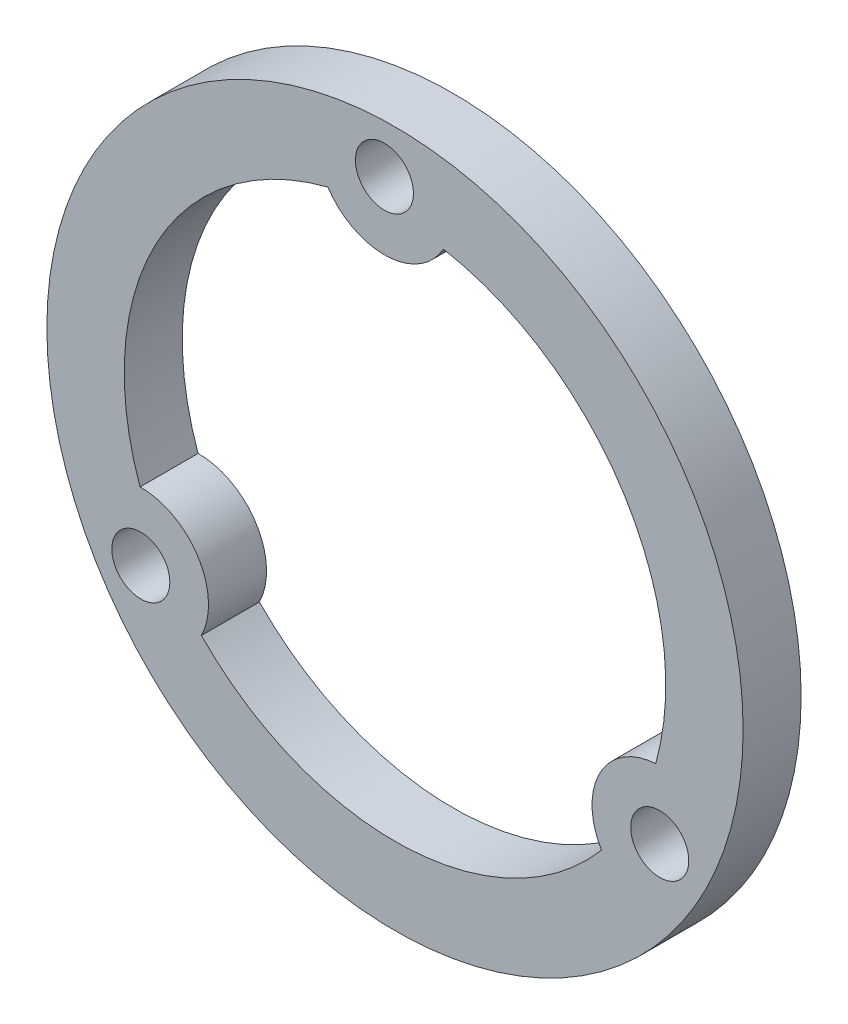
from build123d import *

# Parameters (mm, degrees)
ESQUISSE1_R        = 18
ESQUISSE1_R_2      = 1.5
BOSS_EXTRU_2_DEPTH = 3


with BuildPart() as part:
    # Esquisse1 → Boss.-Extru.2 (new body)
    with BuildSketch(Plane.XY):
        Circle(ESQUISSE1_R)
        with Locations((-0.546712729, 15.490355231)):
            Circle(ESQUISSE1_R_2, mode=Mode.SUBTRACT)
        with Locations((-13.14168478, -8.218644727)):
            Circle(ESQUISSE1_R_2, mode=Mode.SUBTRACT)
        with Locations((13.688397508, -7.271710504)):
            Circle(ESQUISSE1_R_2, mode=Mode.SUBTRACT)
        with BuildLine():
            ThreePointArc((-3.468577117, 13.56351624), (-0.423261467, 11.992533082), (2.503723019, 13.774301109))
            ThreePointArc((2.503723019, 13.774301109), (11.869908833, 7.423292012), (13.480638187, -3.777882222))
            ThreePointArc((13.480638187, -3.777882222), (10.597469039, -5.629711358), (10.677033171, -9.055438293))
            ThreePointArc((10.677033171, -9.055438293), (0.493805045, -13.991288596), (-10.01206107, -9.785634018))
            ThreePointArc((-10.01206107, -9.785634018), (-10.174207571, -6.362821724), (-13.180756189, -4.718862816))
            ThreePointArc((-13.180756189, -4.718862816), (-12.363713879, 6.567996584), (-3.468577117, 13.56351624))
        make_face(mode=Mode.SUBTRACT)
    extrude(amount=BOSS_EXTRU_2_DEPTH)


solid = part.part
